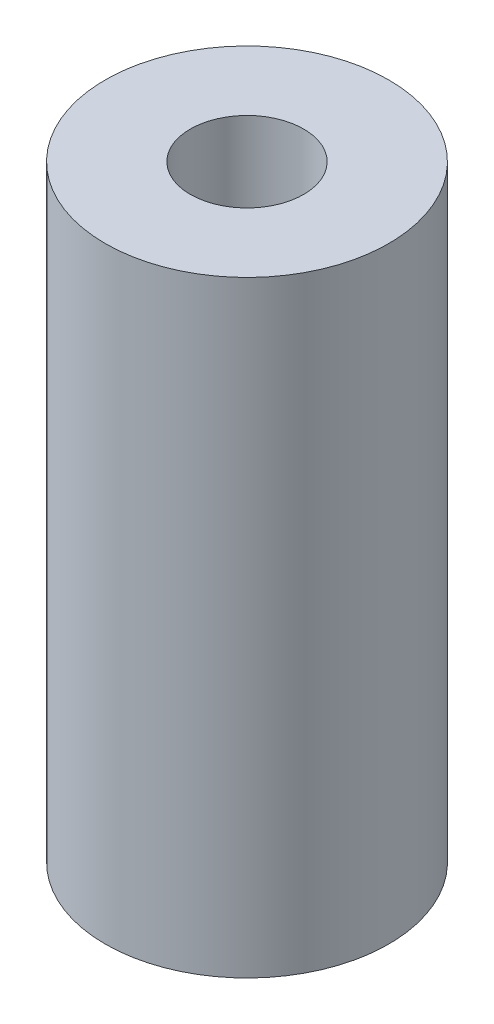
from build123d import *

# Parameters (mm, degrees)
SKETCH1_R           = 6.35
SKETCH1_R_2         = 2.54
BOSS_EXTRUDE1_DEPTH = 27.178


with BuildPart() as part:
    # Sketch1 → Boss-Extrude1 (new body)
    with BuildSketch(Plane(origin=(0, 0, 0), x_dir=(1, 0, 0), z_dir=(0, 1, 0))):
        with Locations(Location((0, 0, 0), (0, 0, 270))):
            Circle(SKETCH1_R)
        with Locations(Location((0, 0, 0), (0, 0, 270))):
            Circle(SKETCH1_R_2, mode=Mode.SUBTRACT)
    extrude(amount=BOSS_EXTRUDE1_DEPTH)


solid = part.part
